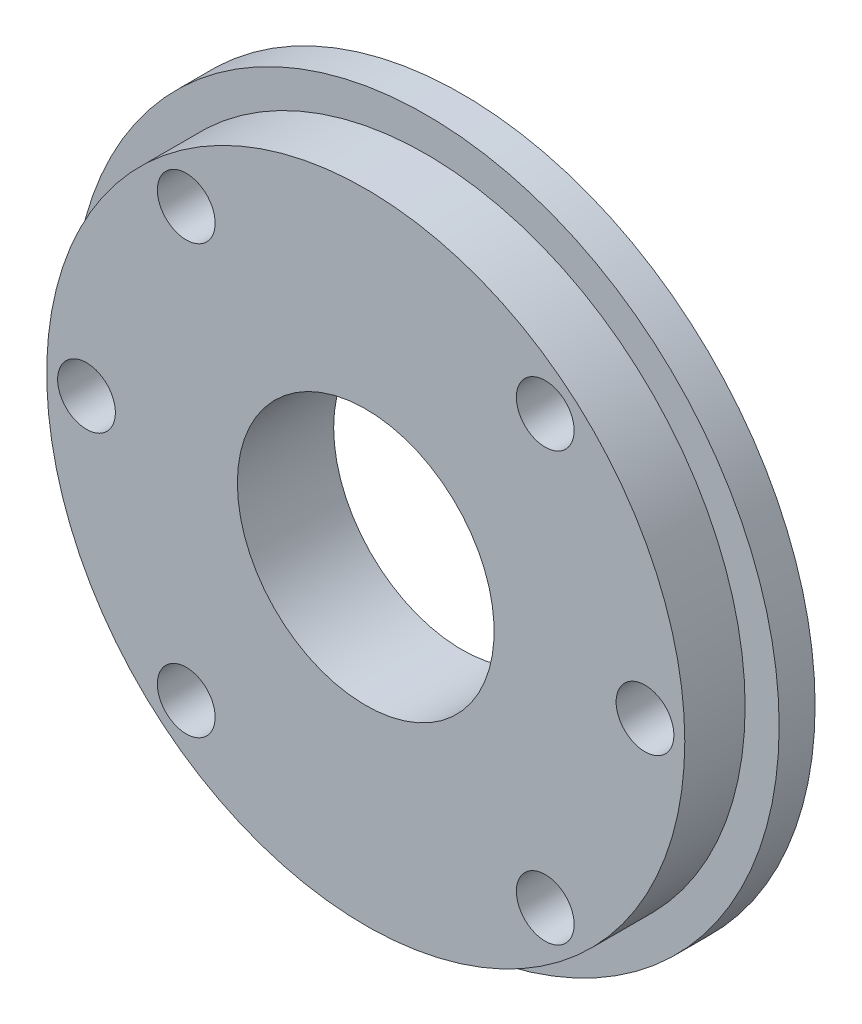
from build123d import *

# Parameters (mm, degrees)
SKETCH_1_R          = 24.85
SKETCH_1_R_2        = 2.25
EXTRUDE_1_DEPTH     = 7.5
SKETCH_3_R          = 27.5
SKETCH_3_R_2        = 24.85
EXTRUDE_2_DEPTH     = 2.8
SKETCH_4_R          = 10
CUT_EXTRUDE_1_DEPTH = 40.607448794


with BuildPart() as part:
    # 草图1 → 凸台-拉伸1 (new body)
    with BuildSketch(Plane.XY):
        Circle(SKETCH_1_R)
        with Locations((-21.75, 0)):
            Circle(SKETCH_1_R_2, mode=Mode.SUBTRACT)
        with Locations((-13.980630511, 16.661466638)):
            Circle(SKETCH_1_R_2, mode=Mode.SUBTRACT)
        with Locations((-13.980630511, -16.661466638)):
            Circle(SKETCH_1_R_2, mode=Mode.SUBTRACT)
        with Locations((13.980630511, -16.661466638)):
            Circle(SKETCH_1_R_2, mode=Mode.SUBTRACT)
        with Locations((21.75, 0)):
            Circle(SKETCH_1_R_2, mode=Mode.SUBTRACT)
        with Locations((13.980630511, 16.661466638)):
            Circle(SKETCH_1_R_2, mode=Mode.SUBTRACT)
    extrude(amount=EXTRUDE_1_DEPTH)

    # 草图3 → 凸台-拉伸2 (add)
    with BuildSketch(Plane.XY):
        Circle(SKETCH_3_R)
        Circle(SKETCH_3_R_2, mode=Mode.SUBTRACT)
    extrude(amount=EXTRUDE_2_DEPTH)

    # 草图4 → 切除-拉伸1 (cut, through all)
    with BuildSketch(Plane(origin=(0, 0, 0), x_dir=(-1, 0, 0), z_dir=(0, 0, -1))):
        Circle(SKETCH_4_R)
    extrude(amount=-CUT_EXTRUDE_1_DEPTH, mode=Mode.SUBTRACT)


solid = part.part
